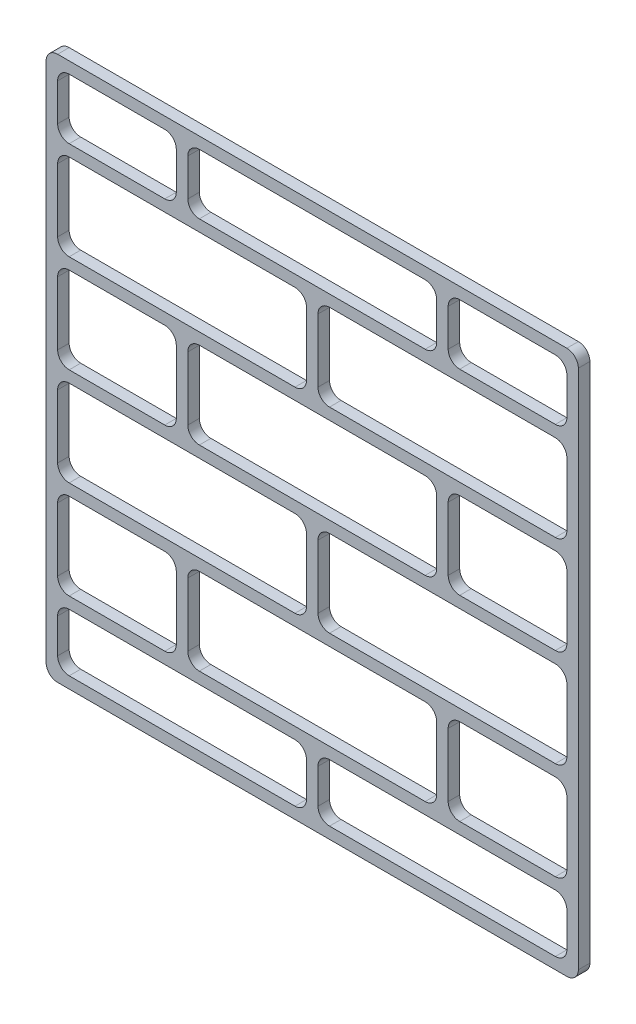
from build123d import *

# Parameters (mm, degrees)
IZIM1_W                     = 92.4
IZIM1_H                     = 94.45
IZIM1_W_2                   = 20.6
IZIM1_H_2                   = 10.45
IZIM1_W_3                   = 43.2
IZIM1_H_3                   = 10
IZIM1_H_4                   = 15
Y_KSEKLIK_EKSTR_ZYON1_DEPTH = 2
RADYUS1_R                   = 2


with BuildPart() as part:
    # Çizim1 → Yükseklik-Ekstrüzyon1 (new body)
    with BuildSketch(Plane.XY):
        Rectangle(IZIM1_W, IZIM1_H)
        with Locations((-33.9, 40)):
            Rectangle(IZIM1_W_2, IZIM1_H_2, mode=Mode.SUBTRACT)
        with Locations((-22.6, -40.225)):
            Rectangle(IZIM1_W_3, IZIM1_H_3, mode=Mode.SUBTRACT)
        with Locations((22.6, -40.225)):
            Rectangle(IZIM1_W_3, IZIM1_H_3, mode=Mode.SUBTRACT)
        with Locations((-33.9, -25.725)):
            Rectangle(IZIM1_W_2, IZIM1_H_4, mode=Mode.SUBTRACT)
        with Locations((-22.6, -8.725)):
            Rectangle(IZIM1_W_3, IZIM1_H_4, mode=Mode.SUBTRACT)
        with Locations((-33.9, 8.275)):
            Rectangle(IZIM1_W_2, IZIM1_H_4, mode=Mode.SUBTRACT)
        with Locations((-22.6, 25.275)):
            Rectangle(IZIM1_W_3, IZIM1_H_4, mode=Mode.SUBTRACT)
        with Locations((33.9, -25.725)):
            Rectangle(IZIM1_W_2, IZIM1_H_4, mode=Mode.SUBTRACT)
        with Locations((22.6, -8.725)):
            Rectangle(IZIM1_W_3, IZIM1_H_4, mode=Mode.SUBTRACT)
        with Locations((33.9, 8.275)):
            Rectangle(IZIM1_W_2, IZIM1_H_4, mode=Mode.SUBTRACT)
        with Locations((22.6, 25.275)):
            Rectangle(IZIM1_W_3, IZIM1_H_4, mode=Mode.SUBTRACT)
        with Locations((33.9, 40)):
            Rectangle(IZIM1_W_2, IZIM1_H_2, mode=Mode.SUBTRACT)
        with Locations((0, 40)):
            Rectangle(IZIM1_W_3, IZIM1_H_2, mode=Mode.SUBTRACT)
        with Locations((0, 8.275)):
            Rectangle(IZIM1_W_3, IZIM1_H_4, mode=Mode.SUBTRACT)
        with Locations((0, -25.725)):
            Rectangle(IZIM1_W_3, IZIM1_H_4, mode=Mode.SUBTRACT)
    extrude(amount=Y_KSEKLIK_EKSTR_ZYON1_DEPTH)

    # Radyus1
    radyus1_edges = [part.edges().sort_by_distance(p)[0] for p in [
        (1, -16.225, 1),
        (44.2, -16.225, 1),
        (44.2, -1.225, 1),
        (1, -1.225, 1),
        (-44.2, 15.775, 1),
        (-44.2, 0.775, 1),
        (-23.6, 0.775, 1),
        (-23.6, 15.775, 1),
        (23.6, 0.775, 1),
        (44.2, 0.775, 1),
        (44.2, 15.775, 1),
        (23.6, 15.775, 1),
        (-44.2, 32.775, 1),
        (-44.2, 17.775, 1),
        (-1, 17.775, 1),
        (-1, 32.775, 1),
        (44.2, 45.225, 1),
        (1, 17.775, 1),
        (44.2, 17.775, 1),
        (44.2, 32.775, 1),
        (1, 32.775, 1),
        (23.6, 45.225, 1),
        (23.6, 34.775, 1),
        (44.2, 34.775, 1),
        (-21.6, 34.775, 1),
        (21.6, 34.775, 1),
        (21.6, 45.225, 1),
        (-21.6, 45.225, 1),
        (-21.6, 0.775, 1),
        (21.6, 0.775, 1),
        (21.6, 15.775, 1),
        (-21.6, 15.775, 1),
        (21.6, -18.225, 1),
        (-21.6, -18.225, 1),
        (-21.6, -33.225, 1),
        (21.6, -33.225, 1),
        (-44.2, -35.225, 1),
        (-44.2, -45.225, 1),
        (-1, -45.225, 1),
        (-1, -35.225, 1),
        (-23.6, 45.225, 1),
        (-44.2, 45.225, 1),
        (-44.2, 34.775, 1),
        (-23.6, 34.775, 1),
        (1, -45.225, 1),
        (44.2, -45.225, 1),
        (44.2, -35.225, 1),
        (1, -35.225, 1),
        (-44.2, -18.225, 1),
        (-44.2, -33.225, 1),
        (-23.6, -33.225, 1),
        (-23.6, -18.225, 1),
        (46.2, -47.225, 1),
        (-46.2, -47.225, 1),
        (23.6, -33.225, 1),
        (-46.2, 47.225, 1),
        (44.2, -33.225, 1),
        (44.2, -18.225, 1),
        (23.6, -18.225, 1),
        (46.2, 47.225, 1),
        (-44.2, -1.225, 1),
        (-44.2, -16.225, 1),
        (-1, -16.225, 1),
        (-1, -1.225, 1),
    ]]
    fillet(radyus1_edges, radius=RADYUS1_R)


solid = part.part
